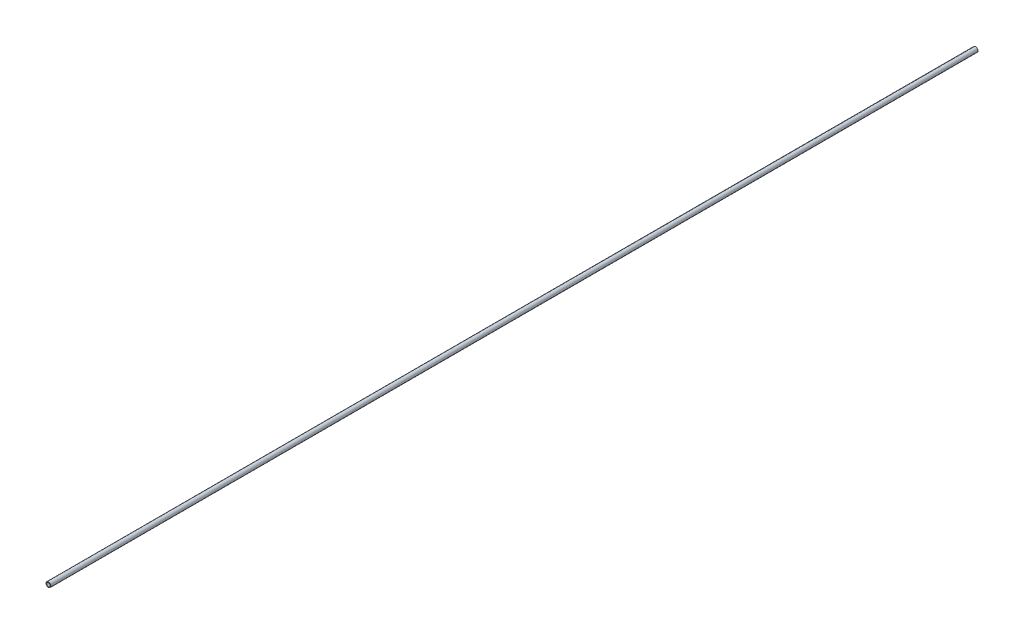
from build123d import *

# Parameters (mm, degrees)
SKETCH1_R           = 6.35
SKETCH1_R_2         = 4.7625
BOSS_EXTRUDE1_DEPTH = 2438.4


with BuildPart() as part:
    # Sketch1 → Boss-Extrude1 (new body)
    with BuildSketch(Plane.XY):
        with Locations(Location((0, 0, 0), (0, 0, 180))):
            Circle(SKETCH1_R)
        with Locations(Location((0, 0, 0), (0, 0, 180))):
            Circle(SKETCH1_R_2, mode=Mode.SUBTRACT)
    extrude(amount=BOSS_EXTRUDE1_DEPTH)


solid = part.part
